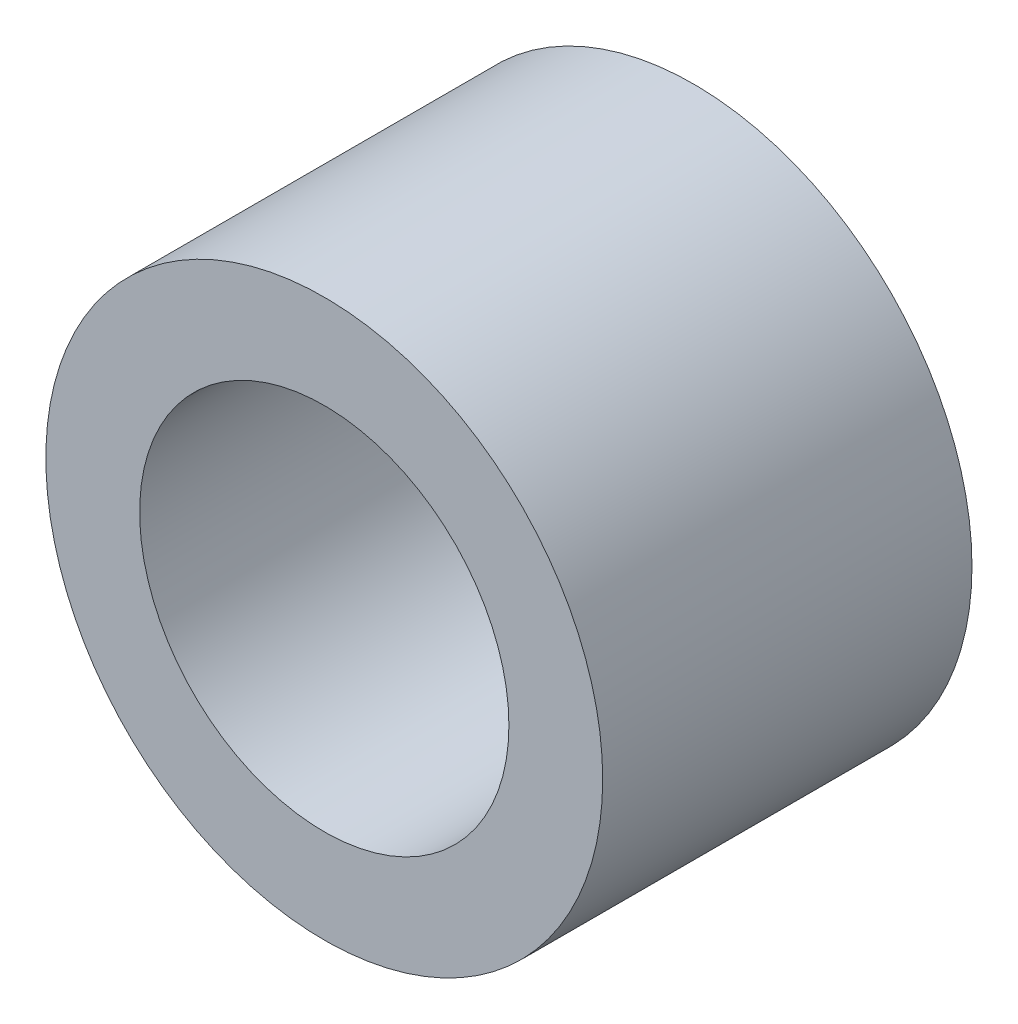
from build123d import *

# Parameters (mm, degrees)
SKETCH1_R      = 4.7879
SKETCH1_R_2    = 3.175
EXTRUDE1_DEPTH = 3.175


with BuildPart() as part:
    # Sketch1 → Extrude1 (new, symmetric)
    with BuildSketch(Plane.XY):
        Circle(SKETCH1_R)
        Circle(SKETCH1_R_2, mode=Mode.SUBTRACT)
    extrude(amount=EXTRUDE1_DEPTH, both=True)


solid = part.part
